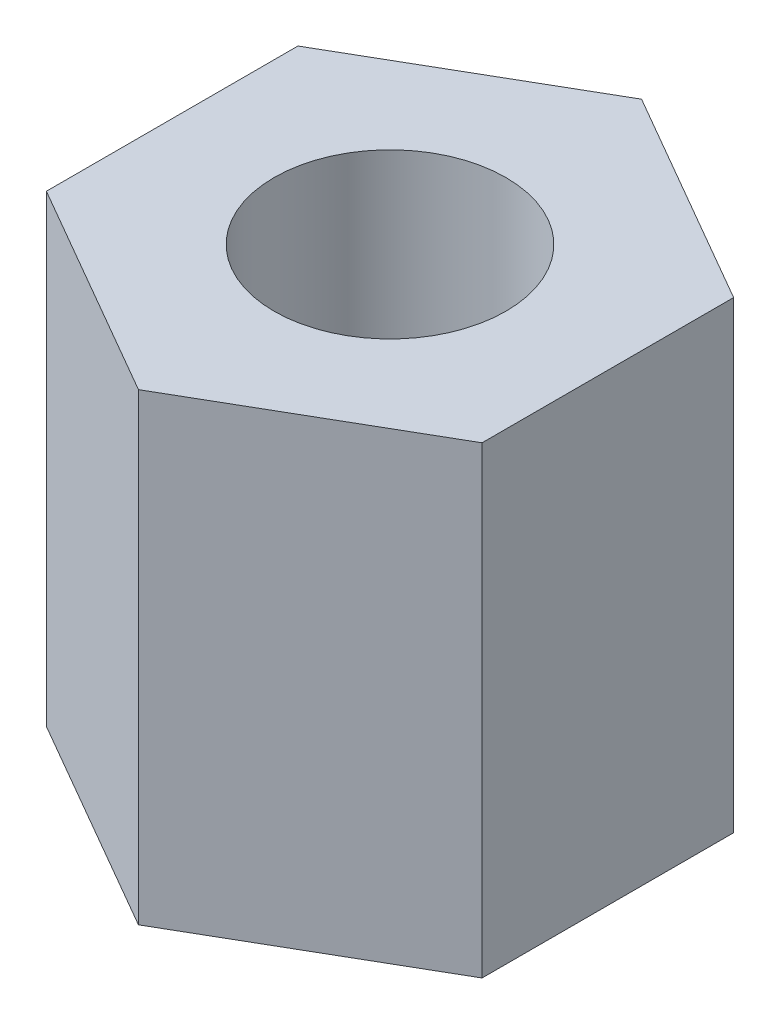
from build123d import *

# Parameters (mm, degrees)
SKETCH_1_R      = 1.25
EXTRUDE_1_DEPTH = 5


with BuildPart() as part:
    # 草图1 → 凸台-拉伸1 (new body)
    with BuildSketch(Plane(origin=(0, 0, 0), x_dir=(1, 0, 0), z_dir=(0, 1, 0))):
        Polygon((0, 2.713546265), (-2.35, 1.356773133), (-2.35, -1.356773133), (0, -2.713546265), (2.35, -1.356773133), (2.35, 1.356773133), align=None)
        with Locations(Location((0, 0, 0), (0, 0, 270))):
            Circle(SKETCH_1_R, mode=Mode.SUBTRACT)
    extrude(amount=EXTRUDE_1_DEPTH)


solid = part.part
